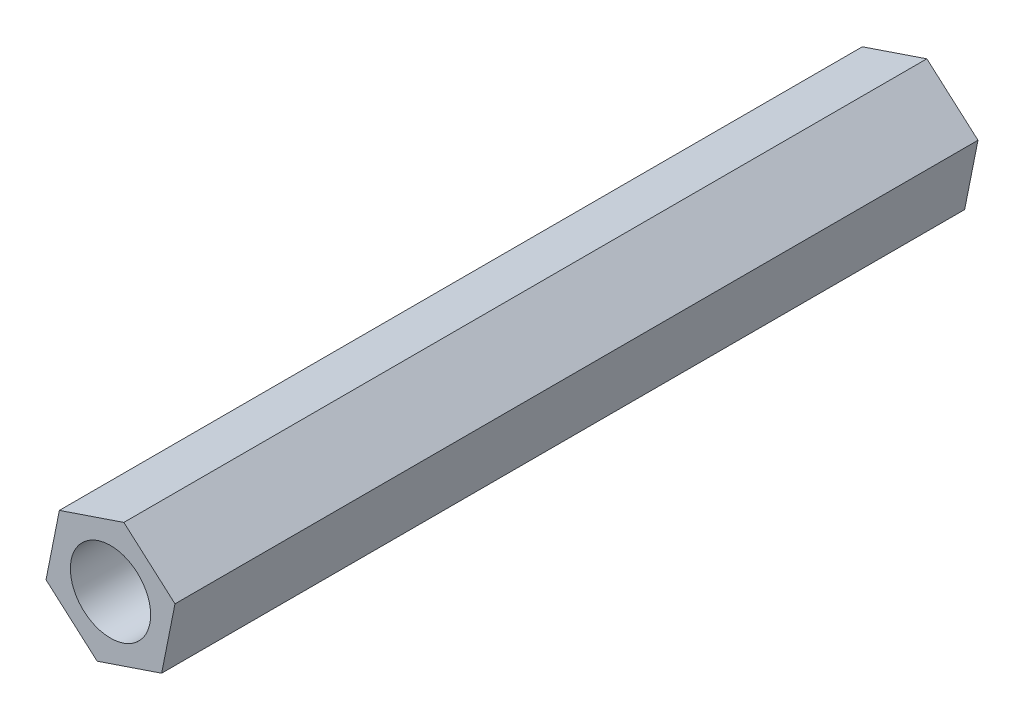
from build123d import *

# Parameters (mm, degrees)
SKETCH_1_R      = 1.6
EXTRUDE_1_DEPTH = 32


with BuildPart() as part:
    # 草图1 → 凸台-拉伸1 (new body)
    with BuildSketch(Plane.XY):
        Polygon((2.038448857, -1.79110569), (2.570367457, 0.869795649), (0.5319186, 2.660901339), (-2.038448857, 1.79110569), (-2.570367457, -0.869795649), (-0.5319186, -2.660901339), align=None)
        Circle(SKETCH_1_R, mode=Mode.SUBTRACT)
    extrude(amount=EXTRUDE_1_DEPTH)


solid = part.part
